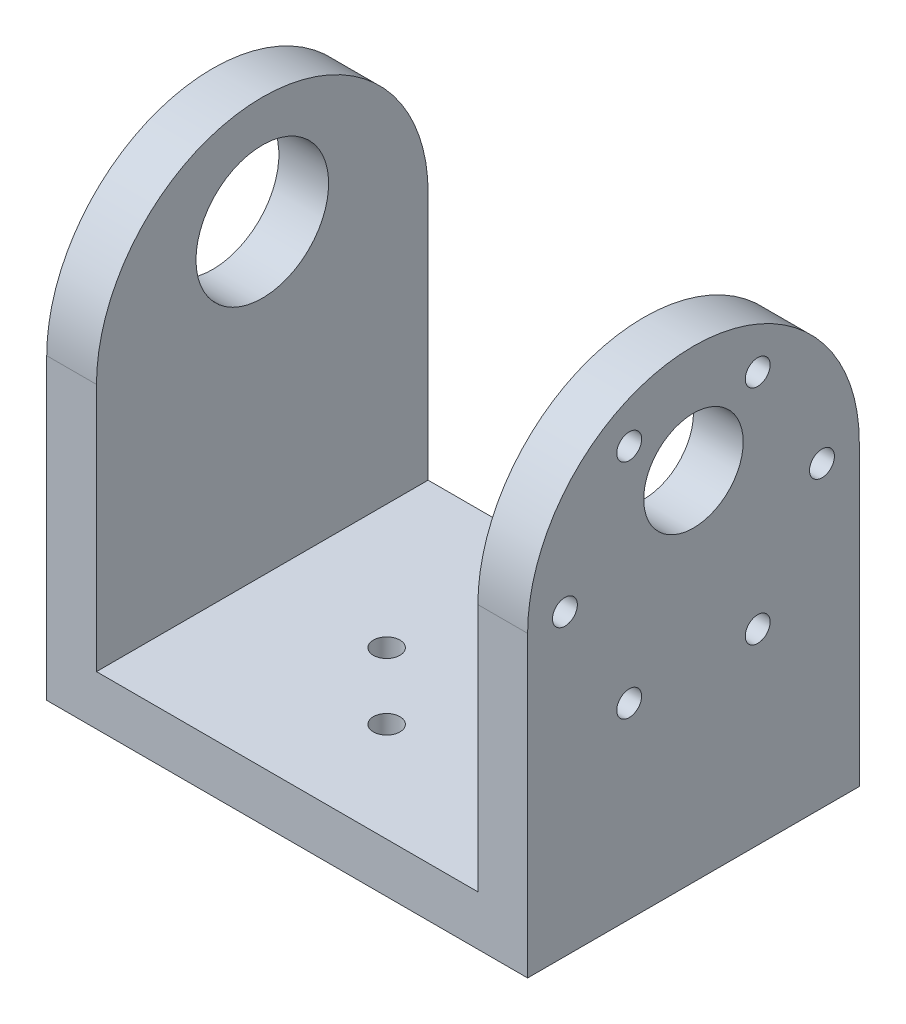
from build123d import *

# Parameters (mm, degrees)
BOSS_EXTRUDE2_DEPTH         = 2
BOSS_EXTRUDE2_DEPTH_BACK    = 4
SKETCH2_W                   = 50
SKETCH2_H                   = 40
BOSS_EXTRUDE3_DEPTH         = 4
BOSS_EXTRUDE3_DEPTH_BACK    = 2
BOSS_EXTRUDE4_DEPTH         = 4
BOSS_EXTRUDE4_DEPTH_BACK    = 2
CUT_EXTRUDE1_DEPTH          = 10
CUT_EXTRUDE1_DEPTH_BACK     = 92
SKETCH7_R                   = 1.5
SKETCH7_R_2                 = 6
SKETCH8_R                   = 3
CUT_EXTRUDE2_DEPTH          = 92
Y_KSEKLIK_EKSTR_ZYON2_DEPTH = 6
SKETCH9_W                   = 11
SKETCH9_H                   = 6
BOSS_EXTRUDE5_DEPTH         = 40
SKETCH10_W                  = 7
SKETCH10_H                  = 40
CUT_EXTRUDE3_DEPTH          = 10
IZIM8_R                     = 2.395734713
KES_EKSTR_ZYON2_DEPTH       = 48
Y_KSEKLIK_EKSTR_ZYON3_DEPTH = 6
IZIM10_R                    = 8
KES_EKSTR_ZYON3_DEPTH       = 6
IZIM11_R                    = 1.6
KES_EKSTR_ZYON5_DEPTH       = 10
IZIM13_R                    = 3.884194159
Y_KSEKLIK_EKSTR_ZYON4_DEPTH = 6


with BuildPart() as part:
    # Sketch2 → Boss-Extrude2 (new, two sides: drawn at the far end of the back side and taken through both)
    with BuildSketch(Plane(origin=(0, 0, 0), x_dir=(1, 0, 0), z_dir=(0, 1, 0)).offset(-BOSS_EXTRUDE2_DEPTH_BACK)):
        with Locations((3.5, 11.198529412)):
            Rectangle(SKETCH2_W, SKETCH2_H)
    extrude(amount=BOSS_EXTRUDE2_DEPTH + BOSS_EXTRUDE2_DEPTH_BACK)

    # Sketch4 → Boss-Extrude3 (add, two sides: drawn at the far end of the back side and taken through both)
    with BuildSketch(Plane.ZY.offset(21.5).offset(-BOSS_EXTRUDE3_DEPTH_BACK)):
        with BuildLine():
            Line((8.801470588, 2), (-31.198529412, 2))
            Line((-31.198529412, 2), (-31.198529412, 32))
            ThreePointArc((-31.198529412, 32), (-11.198529412, 52), (8.801470588, 32))
            Line((8.801470588, 32), (8.801470588, 2))
        make_face()
    extrude(amount=BOSS_EXTRUDE3_DEPTH + BOSS_EXTRUDE3_DEPTH_BACK)

    # Sketch5 → Boss-Extrude4 (add, two sides: drawn at the far end of the back side and taken through both)
    with BuildSketch(Plane(origin=(28.5, 0, 0), x_dir=(0, 0, -1), z_dir=(1, 0, 0)).offset(-BOSS_EXTRUDE4_DEPTH_BACK)):
        with BuildLine():
            Line((-8.801470588, -4), (31.198529412, -4))
            Line((31.198529412, -4), (31.198529412, 32))
            ThreePointArc((31.198529412, 32), (11.198529412, 52), (-8.801470588, 32))
            Line((-8.801470588, 32), (-8.801470588, -4))
        make_face()
    extrude(amount=BOSS_EXTRUDE4_DEPTH + BOSS_EXTRUDE4_DEPTH_BACK)

    # Sketch7 → Cut-Extrude1 (cut, two sides: drawn at the far end of the back side and taken through both)
    with BuildSketch(Plane.ZY.offset(21.5).offset(-CUT_EXTRUDE1_DEPTH_BACK)):
        with Locations(Location((4.301470588, 32, 0), (0, 0, 180))):
            Circle(SKETCH7_R)
        with Locations(Location((-3.448529412, 18.576606241, 0), (0, 0, 180))):
            Circle(SKETCH7_R)
        with Locations(Location((-18.948529412, 18.576606241, 0), (0, 0, 180))):
            Circle(SKETCH7_R)
        with Locations(Location((-26.698529412, 32, 0), (0, 0, 180))):
            Circle(SKETCH7_R)
        with Locations(Location((-18.948529412, 45.423393759, 0), (0, 0, 180))):
            Circle(SKETCH7_R)
        with Locations(Location((-3.448529412, 45.423393759, 0), (0, 0, 180))):
            Circle(SKETCH7_R)
        with Locations(Location((-11.198529412, 39, 0), (0, 0, 180))):
            Circle(SKETCH7_R_2)
    extrude(amount=CUT_EXTRUDE1_DEPTH + CUT_EXTRUDE1_DEPTH_BACK, mode=Mode.SUBTRACT)

    # Sketch8 → Cut-Extrude2 (cut)
    with BuildSketch(Plane(origin=(0, 2, 0), x_dir=(1, 0, 0), z_dir=(0, 1, 0))):
        with Locations(Location((3.5, 11.198529412, 0), (0, 0, 270))):
            Circle(SKETCH8_R)
    extrude(amount=-CUT_EXTRUDE2_DEPTH, mode=Mode.SUBTRACT)

    # Çizim4 → Yükseklik-Ekstrüzyon2 (add)
    with BuildSketch(Plane(origin=(0, 2, 0), x_dir=(1, 0, 0), z_dir=(0, 1, 0))):
        with BuildLine():
            ThreePointArc((6.5, 11.198529412), (6.499830675, 11.230402947), (6.499322719, 11.262272884))
            Line((6.499322719, 11.262272884), (6, 11.262272884))
            Line((6, 11.262272884), (6, 9.540217017))
            ThreePointArc((6, 9.540217017), (6.372281323, 10.332504008), (6.5, 11.198529412))
        make_face()
        with BuildLine():
            Line((6, 11.262272884), (6.499322719, 11.262272884))
            ThreePointArc((6.499322719, 11.262272884), (6.36291811, 12.095022522), (6, 12.856841807))
            Line((6, 12.856841807), (6, 11.262272884))
        make_face()
    extrude(amount=-Y_KSEKLIK_EKSTR_ZYON2_DEPTH)

    # Sketch9 → Boss-Extrude5 (add)
    with BuildSketch(Plane(origin=(0, 0, -31.198529412), x_dir=(-1, 0, 0), z_dir=(0, 0, -1))):
        with Locations((27, -1)):
            Rectangle(SKETCH9_W, SKETCH9_H)
    extrude(amount=-BOSS_EXTRUDE5_DEPTH)

    # Sketch10 → Cut-Extrude3 (cut)
    with BuildSketch(Plane(origin=(0, 2, 0), x_dir=(1, 0, 0), z_dir=(0, 1, 0))):
        with Locations((-29, 11.198529412)):
            Rectangle(SKETCH10_W, SKETCH10_H)
    extrude(amount=-CUT_EXTRUDE3_DEPTH, mode=Mode.SUBTRACT)

    # Çizim8 → Kes-Ekstrüzyon2 (cut)
    with BuildSketch(Plane(origin=(-19.5, 0, 0), x_dir=(0, 0, -1), z_dir=(1, 0, 0))):
        with Locations((-4.301470588, 32)):
            Circle(IZIM8_R)
        with Locations((3.448529412, 45.423393759)):
            Circle(IZIM8_R)
        with Locations((18.948529412, 45.423393759)):
            Circle(IZIM8_R)
        with Locations((26.698529412, 32)):
            Circle(IZIM8_R)
        with Locations((18.948529412, 18.576606241)):
            Circle(IZIM8_R)
        with Locations((3.448529412, 18.576606241)):
            Circle(IZIM8_R)
    extrude(amount=KES_EKSTR_ZYON2_DEPTH, mode=Mode.SUBTRACT)

    # Çizim9 → Yükseklik-Ekstrüzyon3 (add)
    with BuildSketch(Plane.ZY.offset(25.5)):
        with BuildLine():
            Line((8.801470588, -4), (8.801470588, 32))
            ThreePointArc((8.801470588, 32), (-11.198529412, 52), (-31.198529412, 32))
            Line((-31.198529412, 32), (-31.198529412, -4))
            Line((-31.198529412, -4), (8.801470588, -4))
        make_face()
    extrude(amount=-Y_KSEKLIK_EKSTR_ZYON3_DEPTH)

    # Çizim10 → Kes-Ekstrüzyon3 (cut)
    with BuildSketch(Plane.ZY.offset(25.5)):
        with Locations((-11.198529412, 39)):
            Circle(IZIM10_R)
    extrude(amount=-KES_EKSTR_ZYON3_DEPTH, mode=Mode.SUBTRACT)

    # Çizim11 → Kes-Ekstrüzyon5 (cut)
    with BuildSketch(Plane.XZ.offset(4)):
        with Locations(Location((11.5, -11.198529412, 0), (0, 0, 270))):
            Circle(IZIM11_R)
        with Locations(Location((3.5, -19.198529412, 0), (0, 0, 270))):
            Circle(IZIM11_R)
        with Locations(Location((-4.5, -11.198529412, 0), (0, 0, 270))):
            Circle(IZIM11_R)
        with Locations(Location((3.5, -3.198529412, 0), (0, 0, 270))):
            Circle(IZIM11_R)
    extrude(amount=-KES_EKSTR_ZYON5_DEPTH, mode=Mode.SUBTRACT)

    # Çizim13 → Yükseklik-Ekstrüzyon4 (add)
    with BuildSketch(Plane.XZ.offset(4)):
        with Locations((3.5, -11.198529412)):
            Circle(IZIM13_R)
    extrude(amount=-Y_KSEKLIK_EKSTR_ZYON4_DEPTH)


solid = part.part
